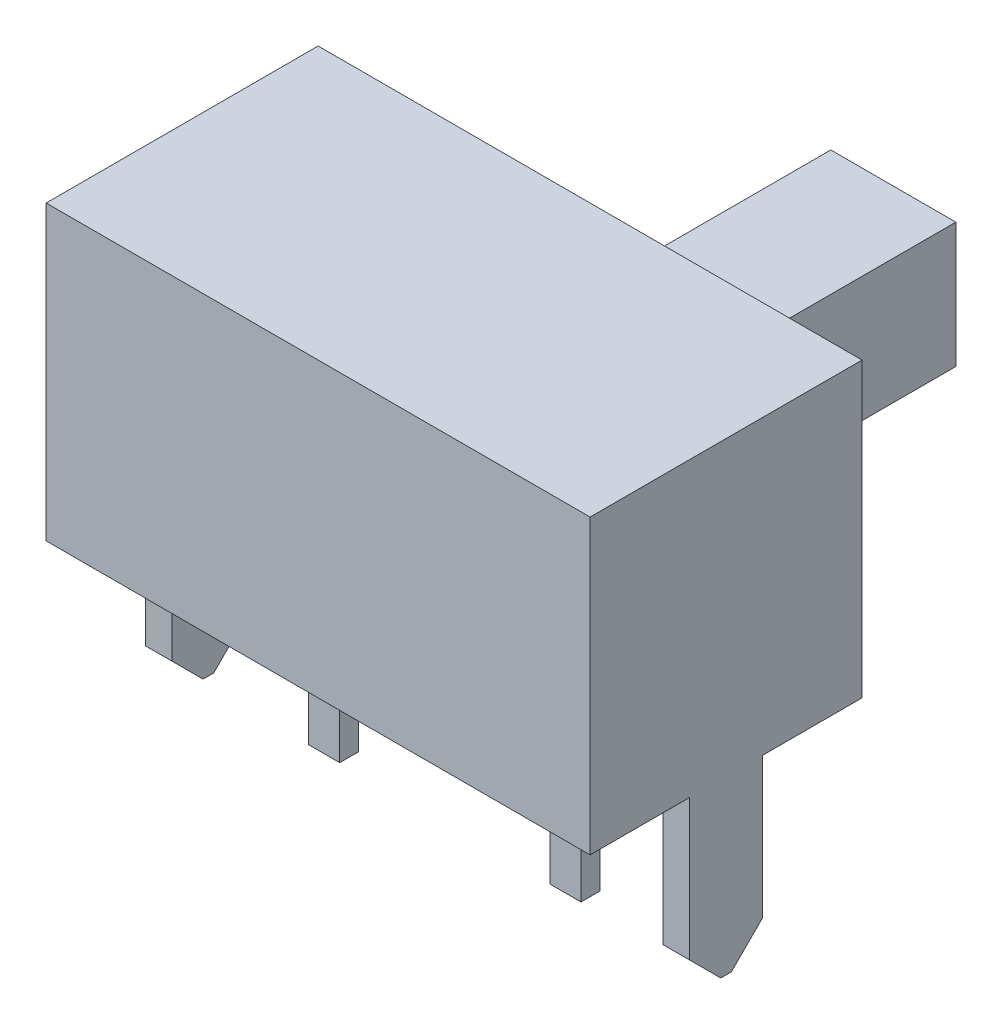
from build123d import *

# Parameters (mm, degrees)
SKETCH1_W                = 8.7
SKETCH1_H                = 4.35
BOSS_EXTRUDE1_DEPTH      = 4.68
SKETCH3_W                = 2
SKETCH3_H                = 2
BOSS_EXTRUDE3_DEPTH      = 4
SKETCH4_W                = 0.42
SKETCH4_H                = 1.17
SKETCH4_W_2              = 0.5
SKETCH4_H_2              = 0.3
BOSS_EXTRUDE4_DEPTH      = 2.75
CHAMFER1_SIZE            = 0.5
CHAMFER1_OF_MIRROR1_SIZE = 0.5


with BuildPart() as part:
    # Sketch1 → Boss-Extrude1 (new body)
    with BuildSketch(Plane(origin=(0, 0, 0), x_dir=(1, 0, 0), z_dir=(0, 1, 0))):
        Rectangle(SKETCH1_W, SKETCH1_H)
    extrude(amount=BOSS_EXTRUDE1_DEPTH)

    # Sketch3 → Boss-Extrude3 (add)
    with BuildSketch(Plane(origin=(0, 0, -2.175), x_dir=(-1, 0, 0), z_dir=(0, 0, -1))):
        with Locations((-0.85, 2.34)):
            Rectangle(SKETCH3_W, SKETCH3_H)
    extrude(amount=BOSS_EXTRUDE3_DEPTH)

    # Sketch4 → Boss-Extrude4 (add)
    with BuildSketch(Plane.XZ):
        with Locations((4.14, 0)):
            Rectangle(SKETCH4_W, SKETCH4_H)
        with Locations((1.93, 0)):
            Rectangle(SKETCH4_W_2, SKETCH4_H_2)
    boss_extrude4 = extrude(amount=BOSS_EXTRUDE4_DEPTH)

    # Chamfer1
    chamfer1_edges = [part.edges().sort_by_distance(p)[0] for p in [
        (4.14, -2.75, 0.585),
        (4.14, -2.75, -0.585),
    ]]
    chamfer(chamfer1_edges, length=CHAMFER1_SIZE)

    # Mirror1: Boss-Extrude4 across plane
    add(boss_extrude4.mirror(Plane(origin=(0, 0, 0), x_dir=(0, 0, 1), z_dir=(1, 0, 0))))

    # Chamfer1 of Mirror1
    chamfer1_of_mirror1_edges = [part.edges().sort_by_distance(p)[0] for p in [
        (-4.14, -2.75, 0.585),
        (-4.14, -2.75, -0.585),
    ]]
    chamfer(chamfer1_of_mirror1_edges, length=CHAMFER1_OF_MIRROR1_SIZE)


solid = part.part
